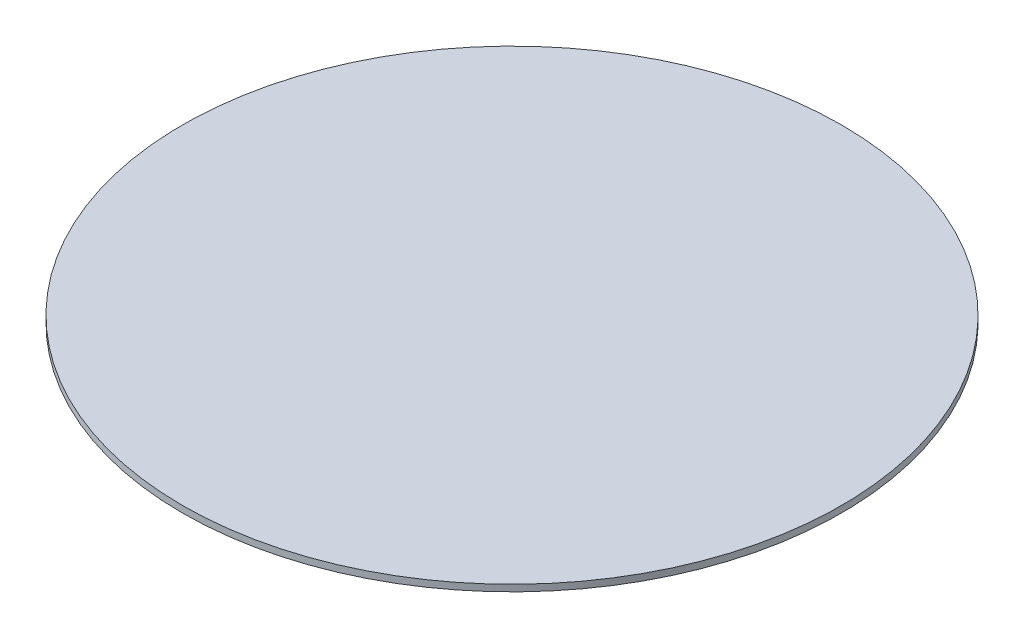
from build123d import *

# Parameters (mm, degrees)
SKETCH1_R           = 300
BOSS_EXTRUDE1_DEPTH = 6


with BuildPart() as part:
    # Sketch1 → Boss-Extrude1 (new body)
    with BuildSketch(Plane(origin=(0, 0, 0), x_dir=(1, 0, 0), z_dir=(0, 1, 0))):
        with Locations(Location((0, 0, 0), (0, 0, 270))):
            Circle(SKETCH1_R)
    extrude(amount=BOSS_EXTRUDE1_DEPTH)


solid = part.part
